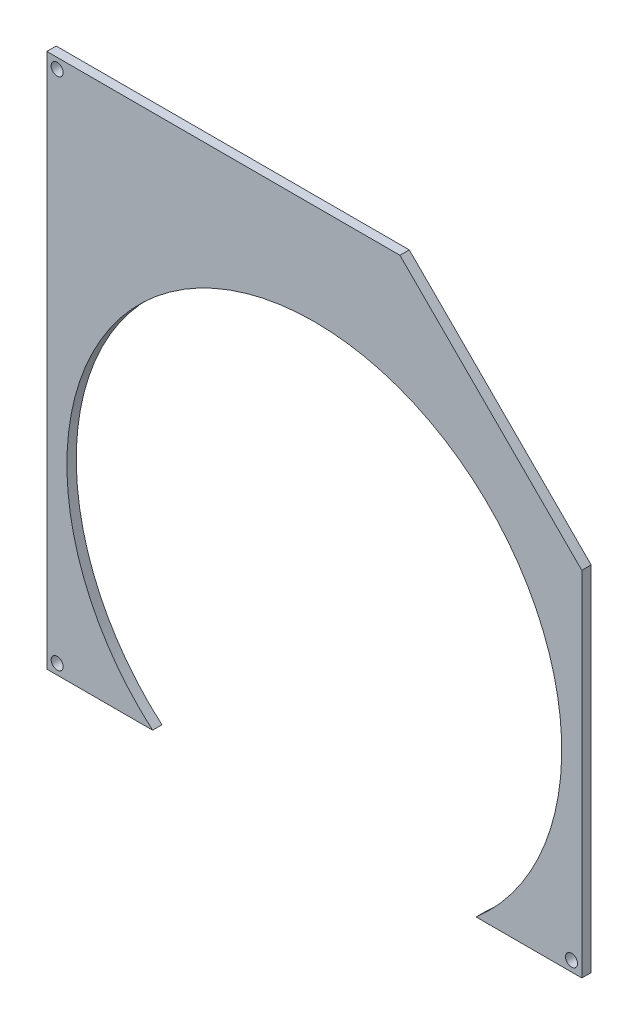
from build123d import *

# Parameters (mm, degrees)
SKETCH1_R           = 2.25
BOSS_EXTRUDE1_DEPTH = 3.5


with BuildPart() as part:
    # Sketch1 → Boss-Extrude1 (new body)
    with BuildSketch(Plane.XY):
        with BuildLine():
            Line((-100, 100), (-100, -100))
            Line((-100, -100), (-60.466933112, -100))
            ThreePointArc((-60.466933112, -100), (-38.490639688, 54.111358665), (92.5, -30))
            ThreePointArc((92.5, -30), (84.111358665, -68.490639688), (60.466933112, -100))
            Line((60.466933112, -100), (100, -100))
            Line((100, -100), (100, 32))
            Line((100, 32), (32, 100))
            Line((32, 100), (-100, 100))
        make_face()
        with Locations((-96.15, -96.15)):
            Circle(SKETCH1_R, mode=Mode.SUBTRACT)
        with Locations((96.15, -96.15)):
            Circle(SKETCH1_R, mode=Mode.SUBTRACT)
        with Locations((-96.15, 96.15)):
            Circle(SKETCH1_R, mode=Mode.SUBTRACT)
    extrude(amount=BOSS_EXTRUDE1_DEPTH)


solid = part.part
